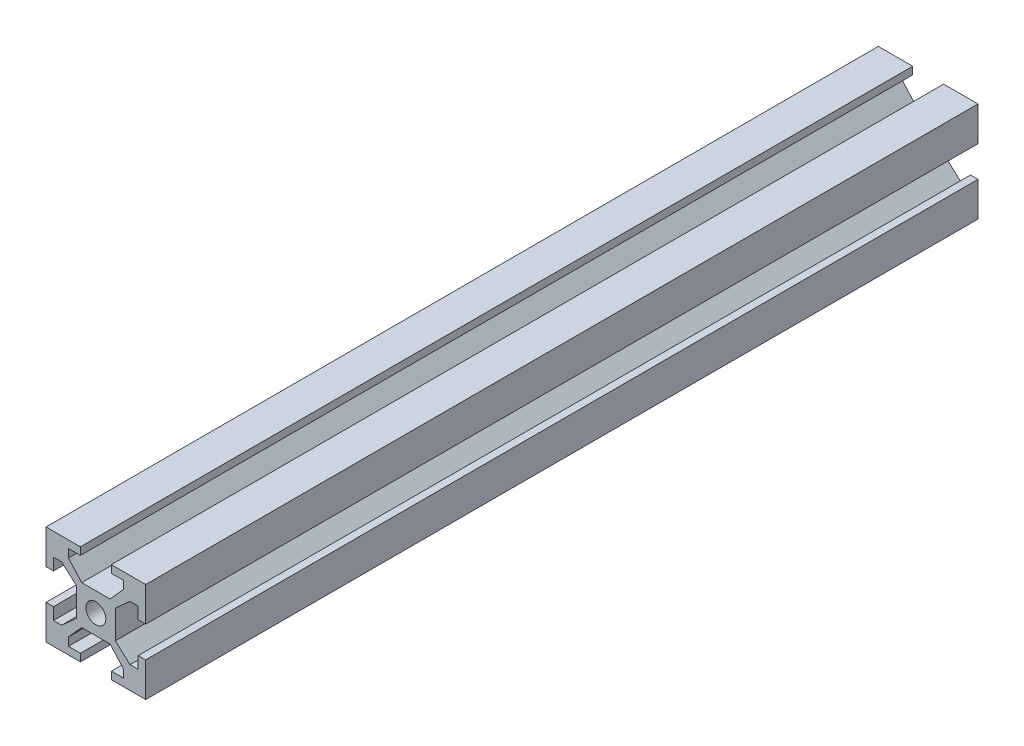
from build123d import *

# Parameters (mm, degrees)
SKETCH1_R           = 2
BOSS_EXTRUDE1_DEPTH = 83.5


with BuildPart() as part:
    # Sketch1 → Boss-Extrude1 (new, symmetric)
    with BuildSketch(Plane.XY):
        Polygon((10, 4.610379336), (10, 10), (4.610379336, 10), (3.1, 10), (3.1, 8.5), (5.5, 8.5), (5.5, 6.860660172), (2.839339828, 3.9), (0.519615242, 3.9), (-0.519615242, 3.9), (-2.839339828, 3.9), (-5.5, 6.860660172), (-5.5, 8.5), (-3.1, 8.5), (-3.1, 10), (-4.610379336, 10), (-10, 10), (-10, 4.610379336), (-10, 3.1), (-8.5, 3.1), (-8.5, 5.5), (-6.860660172, 5.5), (-3.9, 2.839339828), (-3.9, 0.519615242), (-3.9, -0.519615242), (-3.9, -2.839339828), (-6.860660172, -5.5), (-8.5, -5.5), (-8.5, -3.1), (-10, -3.1), (-10, -4.610379336), (-10, -10), (-4.610379336, -10), (-3.1, -10), (-3.1, -8.5), (-5.5, -8.5), (-5.5, -6.860660172), (-2.839339828, -3.9), (-0.519615242, -3.9), (0.519615242, -3.9), (2.839339828, -3.9), (5.5, -6.860660172), (5.5, -8.5), (3.1, -8.5), (3.1, -10), (4.610379336, -10), (10, -10), (10, -4.610379336), (10, -3.1), (8.5, -3.1), (8.5, -5.5), (6.860660172, -5.5), (3.9, -2.839339828), (3.9, -0.519615242), (3.9, 0.519615242), (3.9, 2.839339828), (6.860660172, 5.5), (8.5, 5.5), (8.5, 3.1), (10, 3.1), align=None)
        with Locations(Location((0, 0, 0), (0, 0, 180))):
            Circle(SKETCH1_R, mode=Mode.SUBTRACT)
    extrude(amount=BOSS_EXTRUDE1_DEPTH, both=True)


solid = part.part
